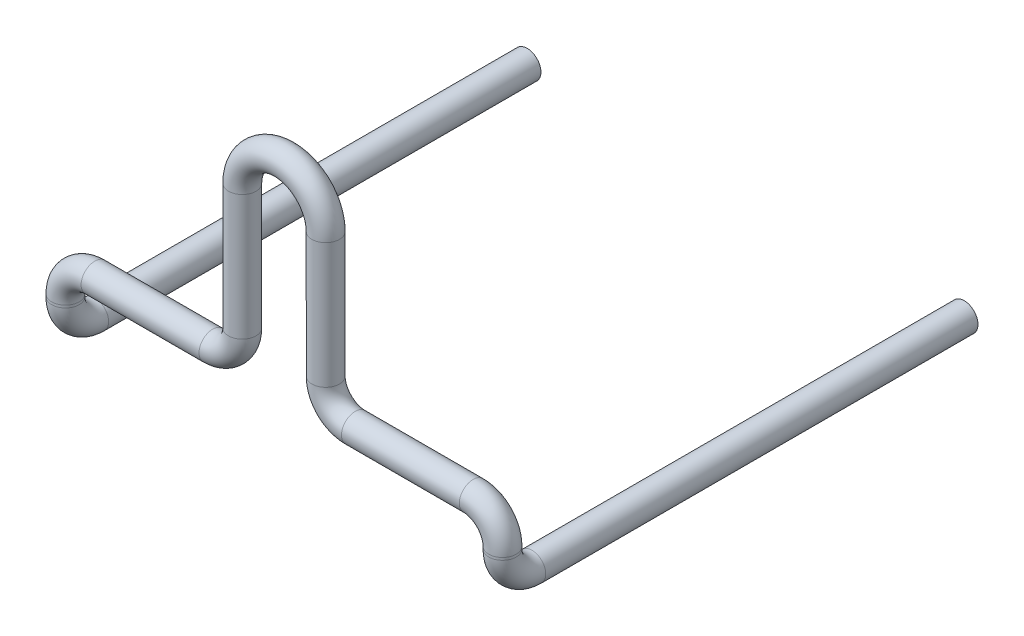
from build123d import *

# Parameters (mm, degrees)
SKETCH_6_R = 1.4


with BuildPart() as part:
    # 扫描2: sweep along a curve in space
    with BuildLine() as sweep_2_path:
        ThreePointArc((0, 26.25, 0), (3.00520382, 25.00520382, 0), (4.25, 22, 0))
        Line((4.25, 22, 0), (4.25, 9.25, 0))
        ThreePointArc((4.25, 9.25, 0), (5.128679656, 7.128679656, 0), (7.25, 6.25, 0))
        Line((7.25, 6.25, 0), (19.25, 6.25, 0))
        ThreePointArc((19.25, 6.25, 0), (21.371320344, 5.371320344, 0), (22.25, 3.25, 0))
        Line((22.25, 3.25, 0), (22.25, 3, 0))
        ThreePointArc((22.25, 3, 0), (22.25, 0.878679656, -0.878679656), (22.25, 0, -3))
        Line((22.25, 0, -3), (22.25, 0, -47))
    # 草图6 → 扫描2 (sweep)
    with BuildSketch(Plane(origin=(0, 0, 0), x_dir=(0, 0, -1), z_dir=(1, 0, 0))):
        with Locations((0, 26.245686093)):
            Circle(SKETCH_6_R)
    sweep_2 = sweep(path=sweep_2_path.line)

    # 镜向1: 扫描2 across plane
    add(sweep_2.mirror(Plane(origin=(0, 0, 0), x_dir=(0, 0, 1), z_dir=(1, 0, 0))))


solid = part.part
